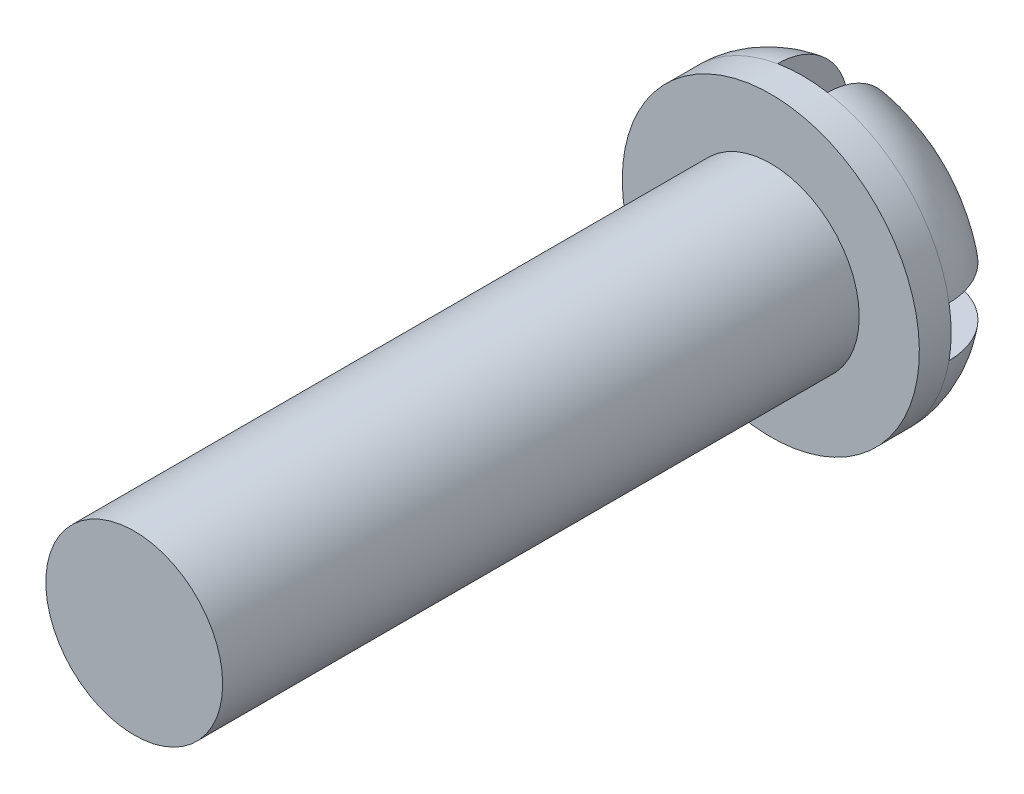
from build123d import *

# Parameters (mm, degrees)
SKETCH_1_R          = 2.5
EXTRUDE_1_DEPTH     = 18
SKETCH_2_R          = 4.2
EXTRUDE_2_DEPTH     = 2.9
FILLET_1_R          = 2
CUT_EXTRUDE_1_DEPTH = 2


with BuildPart() as part:
    # 草图1 → 凸台-拉伸1 (new body)
    with BuildSketch(Plane.XY):
        Circle(SKETCH_1_R)
    extrude(amount=EXTRUDE_1_DEPTH)

    # 草图2 → 凸台-拉伸2 (add)
    with BuildSketch(Plane(origin=(0, 0, 0), x_dir=(-1, 0, 0), z_dir=(0, 0, -1))):
        Circle(SKETCH_2_R)
    extrude(amount=EXTRUDE_2_DEPTH)

    # 圆角1
    fillet_1_edges = [part.edges().sort_by_distance(p)[0] for p in [
        (4.2, 0, -2.9),
    ]]
    fillet(fillet_1_edges, radius=FILLET_1_R)

    # 草图3 → 切除-拉伸1 (cut)
    with BuildSketch(Plane(origin=(0, 0, -2.9), x_dir=(-1, 0, 0), z_dir=(0, 0, -1))):
        Polygon((-0.707106781, 0.707106781), (-0.707106781, 6.006401657), (0.707106781, 6.006401657), (0.707106781, 0.707106781), (6.006401657, 0.707106781), (6.006401657, -0.707106781), (0.707106781, -0.707106781), (0.707106781, -6.006401657), (-0.707106781, -6.006401657), (-0.707106781, -0.707106781), (-6.006401657, -0.707106781), (-6.006401657, 0.707106781), align=None)
    extrude(amount=-CUT_EXTRUDE_1_DEPTH, mode=Mode.SUBTRACT)


solid = part.part
